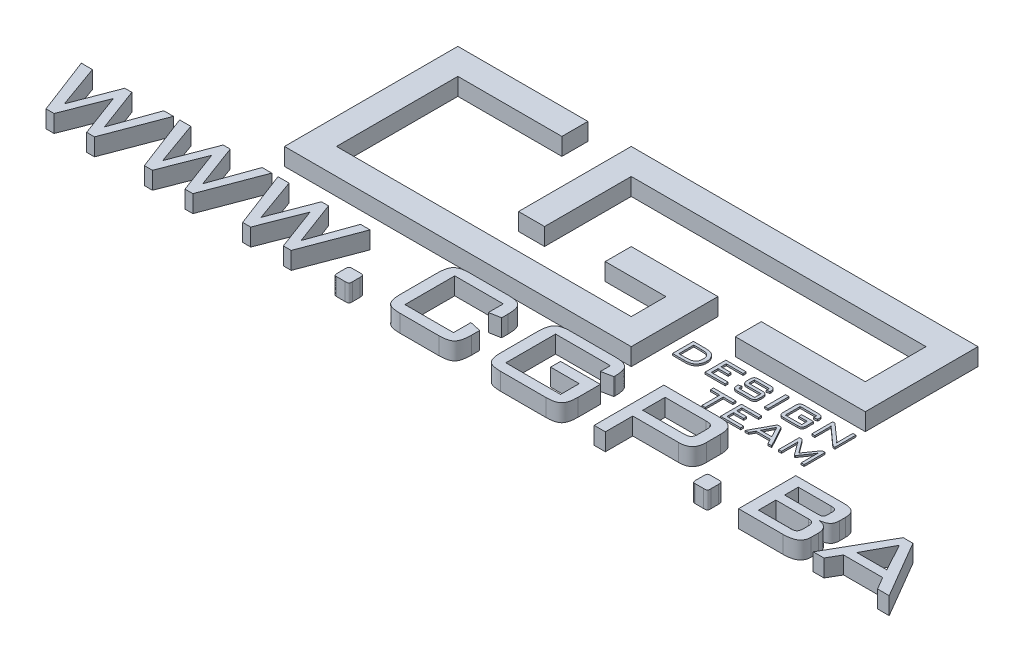
from build123d import *

# Parameters (mm, degrees)
BOSS_EXTRUDE2_DEPTH    = 10
BOSS_EXTRUDE2_2_DEPTH  = 10
BOSS_EXTRUDE4_DEPTH    = 1
BOSS_EXTRUDE4_2_DEPTH  = 1
SKETCH6_W              = 1.938419887
SKETCH6_H              = 12.061279297
BOSS_EXTRUDE4_3_DEPTH  = 1
BOSS_EXTRUDE4_4_DEPTH  = 1
BOSS_EXTRUDE4_5_DEPTH  = 1
BOSS_EXTRUDE4_6_DEPTH  = 1
BOSS_EXTRUDE4_7_DEPTH  = 1
BOSS_EXTRUDE4_8_DEPTH  = 1
BOSS_EXTRUDE4_9_DEPTH  = 1
BOSS_EXTRUDE4_10_DEPTH = 1
BOSS_EXTRUDE6_DEPTH    = 10
BOSS_EXTRUDE6_2_DEPTH  = 10
BOSS_EXTRUDE6_3_DEPTH  = 10
BOSS_EXTRUDE6_4_DEPTH  = 10
BOSS_EXTRUDE6_5_DEPTH  = 10
BOSS_EXTRUDE6_6_DEPTH  = 10
BOSS_EXTRUDE6_7_DEPTH  = 10
BOSS_EXTRUDE6_8_DEPTH  = 10
BOSS_EXTRUDE6_9_DEPTH  = 10
BOSS_EXTRUDE6_10_DEPTH = 10


with BuildPart() as part:
    # Sketch4 → Boss-Extrude2 (new body)
    with BuildSketch(Plane(origin=(0, 0, 0), x_dir=(1, 0, 0), z_dir=(0, 1, 0))):
        Polygon((-150, -35), (50, -35), (50, 15), (0, 15), (0, 0), (35, 0), (35, -20), (-135, -20), (-135, 50), (-75, 50), (-75, 65), (-150, 65), align=None)
    extrude(amount=BOSS_EXTRUDE2_DEPTH)


with BuildPart() as body_2:
    # Sketch4 → Boss-Extrude2 2 (new body)
    with BuildSketch(Plane(origin=(0, 0, 0), x_dir=(1, 0, 0), z_dir=(0, 1, 0))):
        Polygon((-50, 65), (150, 65), (150, 0), (75, 0), (75, 15), (135, 15), (135, 50), (-35, 50), (-35, 0), (-50, 0), align=None)
    extrude(amount=BOSS_EXTRUDE2_2_DEPTH)


with BuildPart() as body_3:
    # Sketch6 → Boss-Extrude4 (new body)
    with BuildSketch(Plane(origin=(0, 0, 0), x_dir=(1, 0, 0), z_dir=(0, 1, 0))):
        with BuildLine():
            Line((136.631120954, -17.5), (136.631120954, -5.438720703))
            Line((136.631120954, -5.438720703), (137.913304942, -5.438720703))
            Line((137.913304942, -5.438720703), (147.04003191, -13.505374295))
            add(Edge.make_bspline(
                [(147.04003191, -13.505374295), (147.148999707, -13.605031879), (147.380381174, -13.816644104), (147.718242534, -14.178371126), (148.07760419, -14.581428781), (148.312267847, -14.872856586), (148.433271204, -15.023130144)],
                knots=[0, 0, 0, 0, 0.858802565, 1.823575424, 2.877735548, 4, 4, 4, 4], degree=3))
            add(Edge.make_bspline(
                [(148.433271204, -15.023130144), (148.407039749, -14.824752386), (148.353645551, -14.420953902), (148.309858819, -13.899598533), (148.282449843, -13.441664675), (148.269951373, -13.034312592), (148.264239897, -12.566469802), (148.262541225, -12.234409631), (148.261640276, -12.058290005)],
                knots=[0, 0, 0, 0, 1.21154109, 2.466095284, 3.166918803, 3.989271989, 4.933540672, 6, 6, 6, 6], degree=3))
            Line((148.261640276, -12.058290005), (148.261640276, -5.438720703))
            Line((148.261640276, -5.438720703), (149.984680176, -5.438720703))
            Line((149.984680176, -5.438720703), (149.984680176, -17.5))
            Line((149.984680176, -17.5), (148.840473992, -17.5))
            Line((148.840473992, -17.5), (139.468079226, -9.113641739))
            add(Edge.make_bspline(
                [(139.468079226, -9.113641739), (139.438786765, -9.089108547), (139.368068506, -9.029880184), (139.299560768, -8.96810307), (139.259429864, -8.931914874)],
                knots=[0, 0, 0, 0, 0.828427125, 2, 2, 2, 2], degree=3))
            add(Edge.make_bspline(
                [(139.259429864, -8.931914874), (139.149023771, -8.83144387), (138.937597844, -8.639043481), (138.659300892, -8.337452934), (138.418621926, -8.049366339), (138.288478785, -7.849553071), (138.226278986, -7.754055568)],
                knots=[0, 0, 0, 0, 1.138972217, 2.181113843, 3.130692929, 4, 4, 4, 4], degree=3))
            add(Edge.make_bspline(
                [(138.226278986, -7.754055568), (138.246982097, -7.942369052), (138.289795582, -8.331796353), (138.317736577, -8.831852946), (138.333677003, -9.259468693), (138.350775735, -9.612672695), (138.350010052, -9.993129946), (138.35275005, -10.256733112), (138.354160854, -10.392460414)],
                knots=[0, 0, 0, 0, 1.290039644, 2.667767836, 3.409457589, 4.204583535, 5.075553461, 6, 6, 6, 6], degree=3))
            Line((138.354160854, -10.392460414), (138.354160854, -17.5))
            Line((138.354160854, -17.5), (136.631120954, -17.5))
        make_face()
    extrude(amount=BOSS_EXTRUDE4_DEPTH)


with BuildPart() as body_4:
    # Sketch6 → Boss-Extrude4 2 (new body)
    with BuildSketch(Plane(origin=(0, 0, 0), x_dir=(1, 0, 0), z_dir=(0, 1, 0))):
        with BuildLine():
            Line((129.092821394, -7.161760603), (119.616101946, -7.161760603))
            Line((119.616101946, -7.161760603), (119.616101946, -15.7769601))
            Line((119.616101946, -15.7769601), (129.092821394, -15.7769601))
            Line((129.092821394, -15.7769601), (129.092821394, -12.546260289))
            Line((129.092821394, -12.546260289), (124.139081682, -12.546260289))
            Line((124.139081682, -12.546260289), (124.139081682, -10.823220389))
            Line((124.139081682, -10.823220389), (131.031241281, -10.823220389))
            Line((131.031241281, -10.823220389), (131.031241281, -14.703425476))
            add(Edge.make_bspline(
                [(131.031241281, -14.703425476), (131.029240672, -14.833603851), (131.025407335, -15.083036759), (130.998323512, -15.440312892), (130.956184945, -15.765611821), (130.893247422, -16.059892827), (130.809430304, -16.320778199), (130.712512591, -16.551546602), (130.594175515, -16.749288838), (130.454020206, -16.918069161), (130.287027854, -17.060818932), (130.088541679, -17.176850849), (129.862204403, -17.278980877), (129.602409974, -17.356915005), (129.313292734, -17.426916952), (128.989348739, -17.466315152), (128.634517926, -17.494371537), (128.387296036, -17.498069389), (128.258223942, -17.5)],
                knots=[0, 0, 0, 0, 1.341190487, 2.569835741, 3.68954282, 4.718799939, 5.665508232, 6.509330321, 7.292302471, 8.030757046, 8.760384973, 9.543357123, 10.391836669, 11.31301249, 12.333536439, 13.453243518, 14.670363738, 16, 16, 16, 16], degree=3))
            Line((128.258223942, -17.5), (120.430507524, -17.5))
            add(Edge.make_bspline(
                [(120.430507524, -17.5), (120.301470114, -17.497865896), (120.054314655, -17.493778279), (119.699982113, -17.468453148), (119.378731791, -17.420439307), (119.08835604, -17.359470716), (118.830858741, -17.273990817), (118.602948759, -17.175379816), (118.409245339, -17.05347723), (118.244630104, -16.911391519), (118.1075862, -16.742432501), (117.993841919, -16.542211673), (117.891244638, -16.314640419), (117.81814287, -16.0517122), (117.751572286, -15.761459914), (117.710913381, -15.436855341), (117.683515521, -15.080816647), (117.679677056, -14.832490187), (117.677682059, -14.703425476)],
                knots=[0, 0, 0, 0, 1.33465139, 2.556362349, 3.670429294, 4.692237, 5.62044689, 6.472126735, 7.254275244, 7.977872778, 8.71172152, 9.491715939, 10.353997527, 11.286331046, 12.308138752, 13.432069147, 14.66534861, 16, 16, 16, 16], degree=3))
            Line((117.677682059, -14.703425476), (117.677682059, -8.339619909))
            add(Edge.make_bspline(
                [(117.677682059, -8.339619909), (117.679701896, -8.206072691), (117.683593145, -7.948791738), (117.710682493, -7.580393231), (117.752032423, -7.243601915), (117.817946163, -6.942068428), (117.890413252, -6.668770719), (117.995189815, -6.43338972), (118.105314759, -6.224206876), (118.245863663, -6.051358995), (118.407557151, -5.901503046), (118.603829182, -5.777920458), (118.828969184, -5.669528732), (119.089083014, -5.587328545), (119.37843619, -5.521253509), (119.699726539, -5.469402194), (120.054339542, -5.445194619), (120.30147865, -5.440941312), (120.430507524, -5.438720703)],
                knots=[0, 0, 0, 0, 1.355439748, 2.611277393, 3.748231333, 4.795615825, 5.743446092, 6.610626162, 7.405817554, 8.134917758, 8.860273934, 9.634062408, 10.479515055, 11.390516792, 12.395899027, 13.491030243, 14.690091812, 16, 16, 16, 16], degree=3))
            Line((120.430507524, -5.438720703), (128.258223942, -5.438720703))
            add(Edge.make_bspline(
                [(128.258223942, -5.438720703), (128.385008919, -5.440936176), (128.629902774, -5.445215514), (128.980989849, -5.469829301), (129.300820651, -5.519074457), (129.591130795, -5.577887869), (129.847798667, -5.669891787), (130.07856547, -5.765382602), (130.274295563, -5.890601198), (130.443170122, -6.03253598), (130.583778417, -6.203844676), (130.705921247, -6.400259016), (130.805367731, -6.628868484), (130.890162344, -6.885423152), (130.951822654, -7.173365919), (130.999454863, -7.490200289), (131.024996866, -7.83777485), (131.029104306, -8.079332442), (131.031241281, -8.205007417)],
                knots=[0, 0, 0, 0, 1.319102502, 2.547936714, 3.656955919, 4.68472133, 5.622055139, 6.489364307, 7.276073175, 8.02917657, 8.774738291, 9.571337848, 10.427983459, 11.361605328, 12.377979269, 13.486998473, 14.692562713, 16, 16, 16, 16], degree=3))
            Line((131.031241281, -8.205007417), (131.031241281, -8.494424275))
            Line((131.031241281, -8.494424275), (129.092821394, -8.884800502))
            Line((129.092821394, -8.884800502), (129.092821394, -7.161760603))
        make_face()
    extrude(amount=BOSS_EXTRUDE4_2_DEPTH)


with BuildPart() as body_5:
    # Sketch6 → Boss-Extrude4 3 (new body)
    with BuildSketch(Plane(origin=(0, 0, 0), x_dir=(1, 0, 0), z_dir=(0, 1, 0))):
        with Locations((110.46245248, -11.469360352)):
            Rectangle(SKETCH6_W, SKETCH6_H)
    extrude(amount=BOSS_EXTRUDE4_3_DEPTH)


with BuildPart() as body_6:
    # Sketch6 → Boss-Extrude4 4 (new body)
    with BuildSketch(Plane(origin=(0, 0, 0), x_dir=(1, 0, 0), z_dir=(0, 1, 0))):
        with BuildLine():
            Line((101.739562988, -7.161760603), (93.124363491, -7.161760603))
            Line((93.124363491, -7.161760603), (93.124363491, -10.392460414))
            Line((93.124363491, -10.392460414), (100.793910231, -10.392460414))
            add(Edge.make_bspline(
                [(100.793910231, -10.392460414), (100.926315037, -10.39460848), (101.181315338, -10.398745471), (101.547895567, -10.424204124), (101.881652965, -10.471501667), (102.183777389, -10.534091865), (102.453949684, -10.616840533), (102.690942474, -10.721256621), (102.895521039, -10.842067417), (103.070214619, -10.984056735), (103.218262707, -11.153331082), (103.342165339, -11.354194308), (103.446659757, -11.587592821), (103.534299058, -11.852244692), (103.594216485, -12.152174648), (103.64767452, -12.481756913), (103.671375454, -12.8465605), (103.675718094, -13.100400763), (103.677982875, -13.232783999)],
                knots=[0, 0, 0, 0, 1.328543116, 2.558660091, 3.684011556, 4.708296874, 5.651654792, 6.513321266, 7.300863837, 8.028632613, 8.762382081, 9.546216273, 10.38734976, 11.323428157, 12.336709029, 13.452564641, 14.671456884, 16, 16, 16, 16], degree=3))
            Line((103.677982875, -13.232783999), (103.677982875, -14.602466106))
            add(Edge.make_bspline(
                [(103.677982875, -14.602466106), (103.675936806, -14.738247909), (103.672026334, -14.997755709), (103.645563456, -15.370899961), (103.600469564, -15.709804605), (103.532446563, -16.014406615), (103.450495172, -16.286137409), (103.345628519, -16.522950316), (103.225127485, -16.728566587), (103.080360536, -16.902428938), (102.90704233, -17.046067187), (102.7038159, -17.168739105), (102.46826304, -17.271594145), (102.198247135, -17.355211208), (101.895534925, -17.421970707), (101.557914424, -17.467915633), (101.186941075, -17.493886541), (100.928565144, -17.497905489), (100.793910231, -17.5)],
                knots=[0, 0, 0, 0, 1.346293302, 2.57305181, 3.707213295, 4.732700712, 5.664975709, 6.516519004, 7.294809232, 8.021131687, 8.747454142, 9.516227799, 10.367771094, 11.289435408, 12.314922825, 13.438067717, 14.664826225, 16, 16, 16, 16], degree=3))
            Line((100.793910231, -17.5), (93.689735958, -17.5))
            add(Edge.make_bspline(
                [(93.689735958, -17.5), (93.562930817, -17.497924324), (93.320234952, -17.493951629), (92.971641675, -17.467836063), (92.655303637, -17.42194617), (92.369955379, -17.355413733), (92.116629655, -17.267606913), (91.891523053, -17.164385148), (91.698478005, -17.040074738), (91.534063884, -16.894347143), (91.396352542, -16.721438064), (91.282679942, -16.515785908), (91.184955561, -16.277461606), (91.10598359, -16.006641544), (91.045808256, -15.702478352), (91.00341314, -15.366248375), (90.976455197, -14.995517581), (90.97258211, -14.737128087), (90.970563616, -14.602466106)],
                knots=[0, 0, 0, 0, 1.295366464, 2.479237682, 3.568301104, 4.557797364, 5.467429819, 6.303022328, 7.081754597, 7.804059379, 8.537817863, 9.328099936, 10.196370306, 11.164467711, 12.205002338, 13.360583175, 14.624444467, 16, 16, 16, 16], degree=3))
            Line((90.970563616, -14.602466106), (90.970563616, -14.272665501))
            Line((90.970563616, -14.272665501), (92.693603516, -13.838540213))
            Line((92.693603516, -13.838540213), (92.693603516, -15.7769601))
            Line((92.693603516, -15.7769601), (101.954942976, -15.7769601))
            Line((101.954942976, -15.7769601), (101.954942976, -12.115500314))
            Line((101.954942976, -12.115500314), (94.137322494, -12.115500314))
            add(Edge.make_bspline(
                [(94.137322494, -12.115500314), (94.009382208, -12.113496013), (93.76330155, -12.109640937), (93.410579402, -12.082392396), (93.089462551, -12.041277489), (92.801782352, -11.976150814), (92.544359587, -11.89827728), (92.320153917, -11.795959462), (92.126489306, -11.679244286), (91.96145508, -11.541534651), (91.828470163, -11.373628309), (91.713814146, -11.179794851), (91.615528639, -10.953841347), (91.536666042, -10.696352797), (91.476770731, -10.406650261), (91.434252591, -10.087244513), (91.407158798, -9.735560917), (91.403325611, -9.490609559), (91.401323591, -9.362674849)],
                knots=[0, 0, 0, 0, 1.336523522, 2.570672591, 3.694432872, 4.715202753, 5.649266837, 6.498934532, 7.282850333, 8.006164405, 8.730996054, 9.508843418, 10.353728782, 11.298975283, 12.317252768, 13.441013048, 14.663476478, 16, 16, 16, 16], degree=3))
            Line((91.401323591, -9.362674849), (91.401323591, -8.356446471))
            add(Edge.make_bspline(
                [(91.401323591, -8.356446471), (91.403322171, -8.220664957), (91.40714188, -7.961157708), (91.434213009, -7.588158018), (91.477286204, -7.248780294), (91.534966817, -6.941696718), (91.617407108, -6.669759207), (91.712103342, -6.430116216), (91.828598594, -6.224832866), (91.961074595, -6.046935517), (92.124990743, -5.898660352), (92.318997501, -5.774443467), (92.544938831, -5.670675894), (92.80030823, -5.58222415), (93.090319876, -5.522441906), (93.409791586, -5.468970841), (93.763432877, -5.445400363), (94.00942713, -5.441005596), (94.137322494, -5.438720703)],
                knots=[0, 0, 0, 0, 1.376570325, 2.630917618, 3.789078705, 4.844084945, 5.793995748, 6.666248003, 7.45058105, 8.18076719, 8.905262556, 9.678132743, 10.507435141, 11.420973463, 12.411545377, 13.505376956, 14.70301555, 16, 16, 16, 16], degree=3))
            Line((94.137322494, -5.438720703), (100.622279303, -5.438720703))
            add(Edge.make_bspline(
                [(100.622279303, -5.438720703), (100.751328509, -5.440821315), (100.999625134, -5.444862988), (101.357132313, -5.470958924), (101.684715321, -5.516875462), (101.980414785, -5.584236405), (102.245723566, -5.665860726), (102.476843811, -5.772842817), (102.681403281, -5.891172316), (102.853939927, -6.037155626), (103.000958262, -6.205221662), (103.127240878, -6.399952708), (103.229131473, -6.624397964), (103.31946836, -6.874471805), (103.378133755, -7.15587553), (103.432077729, -7.461701363), (103.456008961, -7.797440087), (103.460344152, -8.029995591), (103.462602888, -8.15116242)],
                knots=[0, 0, 0, 0, 1.342795848, 2.583601166, 3.727567146, 4.780942874, 5.737020864, 6.609341233, 7.426083684, 8.188290841, 8.949245691, 9.742461551, 10.593595189, 11.509125206, 12.503004008, 13.579536429, 14.738882166, 16, 16, 16, 16], degree=3))
            Line((103.462602888, -8.15116242), (103.462602888, -8.40019553))
            Line((103.462602888, -8.40019553), (101.739562988, -8.884800502))
            Line((101.739562988, -8.884800502), (101.739562988, -7.161760603))
        make_face()
    extrude(amount=BOSS_EXTRUDE4_4_DEPTH)


with BuildPart() as body_7:
    # Sketch6 → Boss-Extrude4 5 (new body)
    with BuildSketch(Plane(origin=(0, 0, 0), x_dir=(1, 0, 0), z_dir=(0, 1, 0))):
        Polygon((75.032444545, -17.5), (75.032444545, -5.438720703), (86.662963867, -5.438720703), (86.662963867, -7.161760603), (76.970864432, -7.161760603), (76.970864432, -10.177080427), (82.786124093, -10.177080427), (82.786124093, -11.900120326), (76.970864432, -11.900120326), (76.970864432, -15.7769601), (86.662963867, -15.7769601), (86.662963867, -17.5), align=None)
    extrude(amount=BOSS_EXTRUDE4_5_DEPTH)


with BuildPart() as body_8:
    # Sketch6 → Boss-Extrude4 6 (new body)
    with BuildSketch(Plane(origin=(0, 0, 0), x_dir=(1, 0, 0), z_dir=(0, 1, 0))):
        with BuildLine():
            add(Edge.make_bspline(
                [(62.85674463, -5.438720703), (63.126014858, -5.441174335), (63.641328587, -5.445869954), (64.378178176, -5.48456848), (65.043192023, -5.554530961), (65.642604853, -5.651195381), (66.18661496, -5.778404351), (66.683104453, -5.940140629), (67.138532068, -6.13223114), (67.413828752, -6.29496964), (67.547989982, -6.374277524)],
                knots=[0, 0, 0, 0, 1.333748036, 2.552449549, 3.653284149, 4.644416963, 5.558188665, 6.417438134, 7.22876497, 8, 8, 8, 8], degree=3))
            add(Edge.make_bspline(
                [(67.547989982, -6.374277524), (67.73840575, -6.508168923), (68.118575278, -6.775486228), (68.616307733, -7.27272913), (69.049025785, -7.8401829), (69.417155164, -8.471045082), (69.712374117, -9.152222561), (69.926439963, -9.871489753), (70.052569995, -10.623593223), (70.069913383, -11.135722548), (70.078704834, -11.395323481)],
                knots=[0, 0, 0, 0, 0.952233827, 1.901157072, 2.86814827, 3.869170434, 4.885987205, 5.902388466, 6.936710154, 8, 8, 8, 8], degree=3))
            add(Edge.make_bspline(
                [(70.078704834, -11.395323481), (70.071611902, -11.670665725), (70.057725662, -12.209719093), (69.92915162, -12.996713454), (69.722334748, -13.742171859), (69.427423144, -14.437306555), (69.068384529, -15.080912849), (68.626794739, -15.648696517), (68.129650887, -16.158729557), (67.742337077, -16.428884363), (67.547989982, -16.56444318)],
                knots=[0, 0, 0, 0, 1.10009359, 2.153716578, 3.178805282, 4.185820525, 5.165972868, 6.115914832, 7.054599989, 8, 8, 8, 8], degree=3))
            add(Edge.make_bspline(
                [(67.547989982, -16.56444318), (67.417128087, -16.641395016), (67.147102205, -16.800180638), (66.698468762, -16.988693115), (66.205439866, -17.150148991), (65.661899364, -17.281169638), (65.059236199, -17.382224632), (64.389199887, -17.449196271), (63.647089465, -17.494320113), (63.128289255, -17.498048519), (62.85674463, -17.5)],
                knots=[0, 0, 0, 0, 0.751442197, 1.55055711, 2.404733238, 3.320026642, 4.317797691, 5.429952807, 6.654814532, 8, 8, 8, 8], degree=3))
            Line((62.85674463, -17.5), (56.294385638, -17.5))
            Line((56.294385638, -17.5), (56.294385638, -5.438720703))
            Line((56.294385638, -5.438720703), (62.85674463, -5.438720703))
        make_face()
        with BuildLine():
            Line((62.570693084, -7.161760603), (58.232805525, -7.161760603))
            Line((58.232805525, -7.161760603), (58.232805525, -15.7769601))
            Line((58.232805525, -15.7769601), (62.570693084, -15.7769601))
            add(Edge.make_bspline(
                [(62.570693084, -15.7769601), (62.806352345, -15.773754987), (63.260220174, -15.767582099), (63.914036804, -15.720055627), (64.514699822, -15.645173966), (65.062086668, -15.535777553), (65.553668192, -15.391221258), (65.993884149, -15.220637776), (66.380799652, -15.016163554), (66.715913772, -14.774497268), (67.004678405, -14.494830785), (67.255746661, -14.178549761), (67.46071032, -13.814401811), (67.633084825, -13.414369099), (67.762141424, -12.970764901), (67.861553384, -12.489547811), (67.912172416, -11.964010938), (67.920554824, -11.600695989), (67.92490496, -11.412150042)],
                knots=[0, 0, 0, 0, 1.409644703, 2.71490448, 3.919338159, 5.028796387, 6.050167232, 6.981044467, 7.848698272, 8.660802914, 9.443886324, 10.246705002, 11.067414674, 11.9362355, 12.847037354, 13.826200672, 14.871884975, 16, 16, 16, 16], degree=3))
            add(Edge.make_bspline(
                [(67.92490496, -11.412150042), (67.92100701, -11.230271759), (67.91347923, -10.879025693), (67.856468255, -10.370935178), (67.760345726, -9.903074336), (67.625185837, -9.474323617), (67.453608838, -9.083670448), (67.242560069, -8.730628862), (66.985503914, -8.421963999), (66.693461292, -8.147592356), (66.351544154, -7.913504316), (65.964514257, -7.706819761), (65.521430384, -7.542638104), (65.031881294, -7.3987652), (64.488122164, -7.296252196), (63.895529746, -7.212690028), (63.249900914, -7.172822109), (62.802934999, -7.16554287), (62.570693084, -7.161760603)],
                knots=[0, 0, 0, 0, 1.103072798, 2.130270712, 3.096451282, 3.99597478, 4.851981305, 5.679355857, 6.481758973, 7.280982183, 8.102093443, 8.987871863, 9.935618735, 10.962816649, 12.079758563, 13.288420765, 14.591072985, 16, 16, 16, 16], degree=3))
        make_face(mode=Mode.SUBTRACT)
    extrude(amount=BOSS_EXTRUDE4_6_DEPTH)


with BuildPart() as body_9:
    # Sketch6 → Boss-Extrude4 7 (new body)
    with BuildSketch(Plane(origin=(0, 0, 0), x_dir=(1, 0, 0), z_dir=(0, 1, 0))):
        with BuildLine():
            add(Edge.make_bspline(
                [(136.540257522, -25.09588589), (136.554849111, -25.215807424), (136.584792836, -25.461901065), (136.604856609, -25.77887657), (136.619273085, -26.056018119), (136.624073649, -26.297310241), (136.63320771, -26.569837033), (136.631840457, -26.761705842), (136.631120954, -26.862674849)],
                knots=[0, 0, 0, 0, 1.228000411, 2.52000689, 3.227952835, 4.049439613, 4.973537463, 6, 6, 6, 6], degree=3))
            Line((136.631120954, -26.862674849), (136.631120954, -35))
            Line((136.631120954, -35), (134.908081055, -35))
            Line((134.908081055, -35), (134.908081055, -22.938720703))
            Line((134.908081055, -22.938720703), (136.570545333, -22.938720703))
            Line((136.570545333, -22.938720703), (142.506956237, -30.789994308))
            Line((142.506956237, -30.789994308), (148.046260289, -22.938720703))
            Line((148.046260289, -22.938720703), (149.769300188, -22.938720703))
            Line((149.769300188, -22.938720703), (149.769300188, -35))
            Line((149.769300188, -35), (148.046260289, -35))
            Line((148.046260289, -35), (148.046260289, -26.862674849))
            add(Edge.make_bspline(
                [(148.046260289, -26.862674849), (148.047305372, -26.825653657), (148.049934452, -26.73252065), (148.057416476, -26.562037987), (148.066296236, -26.331955511), (148.084054817, -26.057285453), (148.099524423, -25.772342497), (148.112982481, -25.510968439), (148.12358164, -25.289995195), (148.128267279, -25.156466303), (148.130393096, -25.09588589)],
                knots=[0, 0, 0, 0, 0.5025012, 1.264125894, 2.315320307, 3.626478431, 4.99841976, 6.187164947, 7.177539063, 8, 8, 8, 8], degree=3))
            add(Edge.make_bspline(
                [(148.130393096, -25.09588589), (148.05966568, -25.240030076), (147.929456742, -25.505399042), (147.735884505, -25.861810452), (147.57246975, -26.154522891), (147.46054281, -26.320339209), (147.410216263, -26.394896439)],
                knots=[0, 0, 0, 0, 1.295888997, 2.385727321, 3.274162517, 4, 4, 4, 4], degree=3))
            Line((147.410216263, -26.394896439), (142.739162786, -33.105329173))
            Line((142.739162786, -33.105329173), (142.217539379, -33.105329173))
            Line((142.217539379, -33.105329173), (137.361393724, -26.579988616))
            add(Edge.make_bspline(
                [(137.361393724, -26.579988616), (137.35459928, -26.571060291), (137.334612411, -26.544796293), (137.316282293, -26.517342273), (137.304183415, -26.499221121)],
                knots=[0, 0, 0, 0, 0.679890819, 2, 2, 2, 2], degree=3))
            add(Edge.make_bspline(
                [(137.304183415, -26.499221121), (137.220749105, -26.381336371), (137.057935415, -26.1512961), (136.846341812, -25.798949802), (136.670073399, -25.449940306), (136.582957489, -25.212344), (136.540257522, -25.09588589)],
                knots=[0, 0, 0, 0, 1.080229624, 2.107959819, 3.072614268, 4, 4, 4, 4], degree=3))
        make_face()
    extrude(amount=BOSS_EXTRUDE4_7_DEPTH)


with BuildPart() as body_10:
    # Sketch6 → Boss-Extrude4 8 (new body)
    with BuildSketch(Plane(origin=(0, 0, 0), x_dir=(1, 0, 0), z_dir=(0, 1, 0))):
        Polygon((115.739262172, -35), (122.261237417, -22.938720703), (124.39821073, -22.938720703), (131.031241281, -35), (128.837057659, -35), (127.312571185, -32.200060163), (119.232456344, -32.200060163), (117.704604558, -35), align=None)
        Polygon((120.067053795, -30.477020264), (126.498165607, -30.477020264), (123.277561733, -24.315133435), align=None, mode=Mode.SUBTRACT)
    extrude(amount=BOSS_EXTRUDE4_8_DEPTH)


with BuildPart() as body_11:
    # Sketch6 → Boss-Extrude4 9 (new body)
    with BuildSketch(Plane(origin=(0, 0, 0), x_dir=(1, 0, 0), z_dir=(0, 1, 0))):
        Polygon((101.524183001, -35), (101.524183001, -22.938720703), (113.154702323, -22.938720703), (113.154702323, -24.661760603), (103.462602888, -24.661760603), (103.462602888, -27.677080427), (109.277862549, -27.677080427), (109.277862549, -29.400120326), (103.462602888, -29.400120326), (103.462602888, -33.2769601), (113.154702323, -33.2769601), (113.154702323, -35), align=None)
    extrude(amount=BOSS_EXTRUDE4_9_DEPTH)


with BuildPart() as body_12:
    # Sketch6 → Boss-Extrude4 10 (new body)
    with BuildSketch(Plane(origin=(0, 0, 0), x_dir=(1, 0, 0), z_dir=(0, 1, 0))):
        Polygon((92.693603516, -24.661760603), (92.693603516, -35), (90.755183629, -35), (90.755183629, -24.661760603), (85.370683943, -24.661760603), (85.370683943, -22.938720703), (98.293483189, -22.938720703), (98.293483189, -24.661760603), align=None)
    extrude(amount=BOSS_EXTRUDE4_10_DEPTH)


with BuildPart() as body_13:
    # Sketch9 → Boss-Extrude6 (new body)
    with BuildSketch(Plane(origin=(0, 0, 0), x_dir=(1, 0, 0), z_dir=(0, 1, 0))):
        Polygon((-237.546177819, -85), (-250.199752081, -51.975068592), (-243.794440996, -51.975068592), (-234.764186314, -77.203693163), (-225.128175418, -51.975068592), (-221.05614753, -51.975068592), (-211.644490787, -77.203693163), (-202.603018397, -51.975068592), (-197.072688511, -51.975068592), (-209.569214866, -85), (-214.089951061, -85), (-223.27725365, -60.388349351), (-232.913264547, -85), align=None)
    extrude(amount=BOSS_EXTRUDE6_DEPTH)


with BuildPart() as body_14:
    # Sketch9 → Boss-Extrude6 2 (new body)
    with BuildSketch(Plane(origin=(0, 0, 0), x_dir=(1, 0, 0), z_dir=(0, 1, 0))):
        Polygon((-180.829447792, -85), (-193.483022054, -51.975068592), (-187.077710969, -51.975068592), (-178.047456287, -77.203693163), (-168.411445391, -51.975068592), (-164.339417503, -51.975068592), (-154.92776076, -77.203693163), (-145.88628837, -51.975068592), (-140.355958484, -51.975068592), (-152.852484839, -85), (-157.373221034, -85), (-166.560523624, -60.388349351), (-176.19653452, -85), align=None)
    extrude(amount=BOSS_EXTRUDE6_2_DEPTH)


with BuildPart() as body_15:
    # Sketch9 → Boss-Extrude6 3 (new body)
    with BuildSketch(Plane(origin=(0, 0, 0), x_dir=(1, 0, 0), z_dir=(0, 1, 0))):
        Polygon((-124.112717765, -85), (-136.766292027, -51.975068592), (-130.360980942, -51.975068592), (-121.33072626, -77.203693163), (-111.694715364, -51.975068592), (-107.622687476, -51.975068592), (-98.211030733, -77.203693163), (-89.169558343, -51.975068592), (-83.639228457, -51.975068592), (-96.135754812, -85), (-100.656491007, -85), (-109.843793597, -60.388349351), (-119.479804493, -85), align=None)
    extrude(amount=BOSS_EXTRUDE6_3_DEPTH)


with BuildPart() as body_16:
    # Sketch9 → Boss-Extrude6 4 (new body)
    with BuildSketch(Plane(origin=(0, 0, 0), x_dir=(1, 0, 0), z_dir=(0, 1, 0))):
        with BuildLine():
            add(Edge.make_bspline(
                [(-65.186099325, -76.384800502), (-64.938956865, -76.38661183), (-64.495429898, -76.389862477), (-63.911946708, -76.466764326), (-63.477413994, -76.573146404), (-63.171866208, -76.767772324), (-63.010969122, -77.071233087), (-62.887223452, -77.444596399), (-62.830461955, -77.935195699), (-62.823171717, -78.295569398), (-62.819163005, -78.493729546)],
                knots=[0, 0, 0, 0, 1.538796082, 2.761555265, 3.661116975, 4.314056044, 4.941546075, 5.752190709, 6.763987982, 8, 8, 8, 8], degree=3))
            Line((-62.819163005, -78.493729546), (-62.819163005, -82.96959491))
            add(Edge.make_bspline(
                [(-62.819163005, -82.96959491), (-62.823752598, -83.167774976), (-62.832002304, -83.523999863), (-62.880893535, -84.004427296), (-62.976319052, -84.369421), (-63.124491261, -84.66260492), (-63.433469379, -84.834602252), (-63.8677956, -84.927703616), (-64.470228864, -84.992125697), (-64.927913792, -84.997160057), (-65.186099325, -85)],
                knots=[0, 0, 0, 0, 1.241128253, 2.230904361, 3.008784951, 3.606767329, 4.216987069, 5.136494925, 6.3846626, 8, 8, 8, 8], degree=3))
            Line((-65.186099325, -85), (-69.875101135, -85))
            add(Edge.make_bspline(
                [(-69.875101135, -85), (-70.013685801, -84.996266298), (-70.270364373, -84.98935095), (-70.620979391, -84.926676998), (-70.901473846, -84.814369899), (-71.131439789, -84.647010986), (-71.278440271, -84.371019291), (-71.372159207, -84.003814875), (-71.421691663, -83.524218087), (-71.429833127, -83.167852983), (-71.434362502, -82.96959491)],
                knots=[0, 0, 0, 0, 1.0915796, 2.02176115, 2.787698927, 3.459470797, 4.212265808, 5.191533172, 6.43755403, 8, 8, 8, 8], degree=3))
            Line((-71.434362502, -82.96959491), (-71.434362502, -78.493729546))
            add(Edge.make_bspline(
                [(-71.434362502, -78.493729546), (-71.430924191, -78.295404825), (-71.424671284, -77.934731835), (-71.36176639, -77.447076194), (-71.255727796, -77.069795164), (-71.09152683, -76.76381962), (-70.777391378, -76.576829273), (-70.342301449, -76.465538702), (-69.757831117, -76.39031106), (-69.314473998, -76.386772347), (-69.067426182, -76.384800502)],
                knots=[0, 0, 0, 0, 1.23413041, 2.244387401, 3.04674342, 3.67327821, 4.344456423, 5.242648711, 6.463546461, 8, 8, 8, 8], degree=3))
            Line((-69.067426182, -76.384800502), (-65.186099325, -76.384800502))
        make_face()
    extrude(amount=BOSS_EXTRUDE6_4_DEPTH)


with BuildPart() as body_17:
    # Sketch9 → Boss-Extrude6 5 (new body)
    with BuildSketch(Plane(origin=(0, 0, 0), x_dir=(1, 0, 0), z_dir=(0, 1, 0))):
        with BuildLine():
            Line((-8.256232852, -50.539202009), (-36.25563122, -50.539202009))
            Line((-36.25563122, -50.539202009), (-36.25563122, -79.256533668))
            Line((-36.25563122, -79.256533668), (-8.256232852, -79.256533668))
            Line((-8.256232852, -79.256533668), (-8.256232852, -69.205467587))
            Line((-8.256232852, -69.205467587), (-1.794833229, -70.607681047))
            Line((-1.794833229, -70.607681047), (-1.794833229, -75.352771396))
            add(Edge.make_bspline(
                [(-1.794833229, -75.352771396), (-1.803611193, -75.801464118), (-1.820522363, -76.66589219), (-1.883845093, -77.908008783), (-2.05239416, -79.032751812), (-2.239884552, -80.050133506), (-2.516895545, -80.946577413), (-2.817745696, -81.748609286), (-3.218105122, -82.419758987), (-3.660416615, -83.007304964), (-4.206272857, -83.486566394), (-4.847610208, -83.892984799), (-5.593223602, -84.241991627), (-6.451162369, -84.513706462), (-7.410256557, -84.741129452), (-8.476503508, -84.892322262), (-9.649478905, -84.979939589), (-10.465958268, -84.993117407), (-10.892394157, -85)],
                knots=[0, 0, 0, 0, 1.371830684, 2.64289768, 3.796878273, 4.845799251, 5.800323197, 6.661932991, 7.455771661, 8.180458924, 8.900807787, 9.661630497, 10.494960316, 11.409299866, 12.407237764, 13.504657088, 14.69671688, 16, 16, 16, 16], degree=3))
            Line((-10.892394157, -85), (-33.507292838, -85))
            add(Edge.make_bspline(
                [(-33.507292838, -85), (-33.933718427, -84.993015139), (-34.753906441, -84.979580441), (-35.934418255, -84.892447347), (-37.011557744, -84.740510212), (-37.979214769, -84.51616256), (-38.842156635, -84.238504836), (-39.600359849, -83.895399538), (-40.245900201, -83.474134067), (-40.80553256, -82.996865285), (-41.262666339, -82.412644159), (-41.654362055, -81.731695664), (-41.994405622, -80.938646298), (-42.250162627, -80.031574133), (-42.470795795, -79.021244468), (-42.60609965, -77.898402744), (-42.697802098, -76.663031527), (-42.710442951, -75.801675003), (-42.717030843, -75.352771396)],
                knots=[0, 0, 0, 0, 1.297259025, 2.495151162, 3.598753169, 4.603154866, 5.513268114, 6.353056325, 7.126090131, 7.85163119, 8.580020311, 9.370189664, 10.236523983, 11.197537223, 12.232772674, 13.379897413, 14.634510254, 16, 16, 16, 16], degree=3))
            Line((-42.717030843, -75.352771396), (-42.717030843, -54.364440328))
            add(Edge.make_bspline(
                [(-42.717030843, -54.364440328), (-42.71039871, -53.919286785), (-42.697677362, -53.065420681), (-42.606644544, -51.841082711), (-42.468790437, -50.726317816), (-42.254638599, -49.725375785), (-41.98912929, -48.828944095), (-41.658137003, -48.043272548), (-41.259186842, -47.370030832), (-40.805485752, -46.788139553), (-40.249095403, -46.309002694), (-39.596545793, -45.902607474), (-38.842753882, -45.556289588), (-37.979030795, -45.279863057), (-37.011614552, -45.055135936), (-35.934401048, -44.903315448), (-34.75391132, -44.816147546), (-33.933720096, -44.802717907), (-33.507292838, -44.795735677)],
                knots=[0, 0, 0, 0, 1.360215605, 2.609081786, 3.750041755, 4.789939032, 5.733390305, 6.603625863, 7.387504429, 8.1191736, 8.847981884, 9.618334873, 10.461904781, 11.37611641, 12.385041084, 13.493612783, 14.696899215, 16, 16, 16, 16], degree=3))
            Line((-33.507292838, -44.795735677), (-10.892394157, -44.795735677))
            add(Edge.make_bspline(
                [(-10.892394157, -44.795735677), (-10.466005197, -44.802795371), (-9.649615685, -44.816312279), (-8.47602657, -44.90161352), (-7.412657047, -45.060419981), (-6.446519755, -45.26261362), (-5.598786619, -45.560607191), (-4.844707278, -45.888440233), (-4.20615667, -46.298522783), (-3.664418379, -46.776464852), (-3.214102271, -47.354242636), (-2.821139376, -48.022612584), (-2.516184399, -48.814906216), (-2.238328301, -49.704086748), (-2.053741964, -50.714577993), (-1.883524051, -51.831538215), (-1.820591313, -53.06254547), (-1.803636566, -53.91949187), (-1.794833229, -54.364440328)],
                knots=[0, 0, 0, 0, 1.308876855, 2.506053008, 3.608182492, 4.60783723, 5.529752035, 6.361843922, 7.12593211, 7.849372733, 8.568155083, 9.365400936, 10.220062916, 11.167696093, 12.221119074, 13.368687144, 14.63375516, 16, 16, 16, 16], degree=3))
            Line((-1.794833229, -54.364440328), (-1.794833229, -57.965324493))
            Line((-1.794833229, -57.965324493), (-8.256232852, -59.154401507))
            Line((-8.256232852, -59.154401507), (-8.256232852, -50.539202009))
        make_face()
    extrude(amount=BOSS_EXTRUDE6_5_DEPTH)


with BuildPart() as body_18:
    # Sketch9 → Boss-Extrude6 6 (new body)
    with BuildSketch(Plane(origin=(0, 0, 0), x_dir=(1, 0, 0), z_dir=(0, 1, 0))):
        with BuildLine():
            Line((53.486030215, -50.539202009), (21.89696539, -50.539202009))
            Line((21.89696539, -50.539202009), (21.89696539, -79.256533668))
            Line((21.89696539, -79.256533668), (53.486030215, -79.256533668))
            Line((53.486030215, -79.256533668), (53.486030215, -68.487534296))
            Line((53.486030215, -68.487534296), (36.973564511, -68.487534296))
            Line((36.973564511, -68.487534296), (36.973564511, -62.744067964))
            Line((36.973564511, -62.744067964), (59.947429839, -62.744067964))
            Line((59.947429839, -62.744067964), (59.947429839, -75.678084918))
            add(Edge.make_bspline(
                [(59.947429839, -75.678084918), (59.940761143, -76.112012837), (59.927983352, -76.943455862), (59.837703942, -78.134376308), (59.697242054, -79.218706072), (59.487450309, -80.199642755), (59.208059916, -81.069260663), (58.885000872, -81.838488675), (58.490543954, -82.497629461), (58.02335959, -83.060230537), (57.466718418, -83.536063106), (56.805097831, -83.922836162), (56.050640246, -84.263269589), (55.184658818, -84.523050018), (54.220934685, -84.75638984), (53.141121367, -84.887717173), (51.958351991, -84.981238458), (51.134279022, -84.993564629), (50.704038711, -85)],
                knots=[0, 0, 0, 0, 1.341190487, 2.569835741, 3.68954282, 4.718799939, 5.665508232, 6.509330321, 7.292302471, 8.030757046, 8.760384973, 9.543357123, 10.391836669, 11.31301249, 12.333536439, 13.453243518, 14.670363738, 16, 16, 16, 16], degree=3))
            Line((50.704038711, -85), (24.611650649, -85))
            add(Edge.make_bspline(
                [(24.611650649, -85), (24.181525949, -84.99288632), (23.35767442, -84.97926093), (22.176565947, -84.894843826), (21.105731539, -84.734797689), (20.137812368, -84.531569052), (19.279488041, -84.246636055), (18.5197881, -83.917932719), (17.874110034, -83.511590766), (17.325392583, -83.037971729), (16.868579569, -82.474775004), (16.489431965, -81.807372245), (16.147441031, -81.048801395), (15.903768471, -80.172374), (15.681866524, -79.204866379), (15.546336838, -78.122851138), (15.455010638, -76.936055492), (15.442215755, -76.108300624), (15.435565767, -75.678084918)],
                knots=[0, 0, 0, 0, 1.33465139, 2.556362349, 3.670429294, 4.692237, 5.62044689, 6.472126735, 7.254275244, 7.977872778, 8.71172152, 9.491715939, 10.353997527, 11.286331046, 12.308138752, 13.432069147, 14.66534861, 16, 16, 16, 16], degree=3))
            Line((15.435565767, -75.678084918), (15.435565767, -54.465399697))
            add(Edge.make_bspline(
                [(15.435565767, -54.465399697), (15.442298555, -54.020242304), (15.455269385, -53.162639125), (15.545567213, -51.934644103), (15.683400312, -50.812006383), (15.903112779, -49.80689476), (16.144669742, -48.895902396), (16.493924954, -48.111299066), (16.861008099, -47.41402292), (17.329504447, -46.837863316), (17.868482738, -46.338343488), (18.522722845, -45.926401526), (19.273189515, -45.565095775), (20.140235616, -45.291095151), (21.104746201, -45.070845029), (22.175714033, -44.898007314), (23.357757376, -44.817315397), (24.181554404, -44.803137708), (24.611650649, -44.795735677)],
                knots=[0, 0, 0, 0, 1.355439748, 2.611277393, 3.748231333, 4.795615825, 5.743446092, 6.610626162, 7.405817554, 8.134917758, 8.860273934, 9.634062408, 10.479515055, 11.390516792, 12.395899027, 13.491030243, 14.690091812, 16, 16, 16, 16], degree=3))
            Line((24.611650649, -44.795735677), (50.704038711, -44.795735677))
            add(Edge.make_bspline(
                [(50.704038711, -44.795735677), (51.1266553, -44.803120587), (51.942968151, -44.817385047), (53.1132584, -44.899431005), (54.179361073, -45.063581523), (55.147061554, -45.259626229), (56.002621126, -45.566305956), (56.771843803, -45.884608672), (57.424277447, -46.302003993), (57.987192642, -46.775119932), (58.455886961, -47.346148918), (58.863029725, -48.000863387), (59.194518006, -48.762894947), (59.477166718, -49.618077174), (59.682701083, -50.577886398), (59.841475113, -51.634000964), (59.926615124, -52.792582834), (59.94030659, -53.597774808), (59.947429839, -54.01669139)],
                knots=[0, 0, 0, 0, 1.319102502, 2.547936714, 3.656955919, 4.68472133, 5.622055139, 6.489364307, 7.276073175, 8.02917657, 8.774738291, 9.571337848, 10.427983459, 11.361605328, 12.377979269, 13.486998473, 14.692562713, 16, 16, 16, 16], degree=3))
            Line((59.947429839, -54.01669139), (59.947429839, -54.98141425))
            Line((59.947429839, -54.98141425), (53.486030215, -56.282668341))
            Line((53.486030215, -56.282668341), (53.486030215, -50.539202009))
        make_face()
    extrude(amount=BOSS_EXTRUDE6_6_DEPTH)


with BuildPart() as body_19:
    # Sketch9 → Boss-Extrude6 7 (new body)
    with BuildSketch(Plane(origin=(0, 0, 0), x_dir=(1, 0, 0), z_dir=(0, 1, 0))):
        with BuildLine():
            Line((78.613695417, -85), (78.613695417, -44.795735677))
            Line((78.613695417, -44.795735677), (111.32453101, -44.795735677))
            add(Edge.make_bspline(
                [(111.32453101, -44.795735677), (111.676239834, -44.802477635), (112.354673363, -44.815482626), (113.332642086, -44.906580131), (114.238121991, -45.047500796), (115.064034607, -45.259232736), (115.818015418, -45.528435138), (116.491400953, -45.86484544), (117.092170588, -46.258167249), (117.617948552, -46.713642059), (118.073755039, -47.239320124), (118.463738684, -47.838059133), (118.803638313, -48.501837363), (119.072347619, -49.245045725), (119.284266819, -50.059709475), (119.424243971, -50.950412606), (119.516339711, -51.909583259), (119.529213851, -52.573112925), (119.535893032, -52.917356037)],
                knots=[0, 0, 0, 0, 1.260781994, 2.432002616, 3.518530085, 4.542732807, 5.484194412, 6.383479385, 7.234929142, 8.052130222, 8.869331302, 9.72078106, 10.60809582, 11.536970088, 12.548193725, 13.621491167, 14.766015563, 16, 16, 16, 16], degree=3))
            Line((119.535893032, -52.917356037), (119.535893032, -61.184806597))
            add(Edge.make_bspline(
                [(119.535893032, -61.184806597), (119.5291544, -61.525304993), (119.516170739, -62.181360377), (119.42531865, -63.125780043), (119.283283379, -64.001346863), (119.07014147, -64.804089454), (118.80621716, -65.541726422), (118.463856176, -66.197362542), (118.070521294, -66.785955323), (117.617794668, -67.309445986), (117.095533208, -67.767092529), (116.487330809, -68.144640292), (115.82093793, -68.487766799), (115.061233979, -68.73804712), (114.238590681, -68.954955774), (113.332503155, -69.094251623), (112.354712378, -69.185824966), (111.676253154, -69.198761249), (111.32453101, -69.205467587)],
                knots=[0, 0, 0, 0, 1.228343777, 2.366711731, 3.420216182, 4.424816797, 5.359594873, 6.240544878, 7.086181298, 7.908576405, 8.730971511, 9.580473227, 10.485473941, 11.42839416, 12.459106585, 13.552539884, 14.731204635, 16, 16, 16, 16], degree=3))
            Line((111.32453101, -69.205467587), (85.07509504, -69.205467587))
            Line((85.07509504, -69.205467587), (85.07509504, -85))
            Line((85.07509504, -85), (78.613695417, -85))
        make_face()
        with BuildLine():
            Line((108.643498875, -50.539202009), (85.07509504, -50.539202009))
            Line((85.07509504, -50.539202009), (85.07509504, -63.462001256))
            Line((85.07509504, -63.462001256), (108.643498875, -63.462001256))
            add(Edge.make_bspline(
                [(108.643498875, -63.462001256), (109.033250973, -63.453827712), (109.749786308, -63.438801153), (110.727576998, -63.270624606), (111.521973359, -63.018124941), (112.140888409, -62.621086898), (112.574815969, -62.06354317), (112.878547106, -61.367558151), (113.049985768, -60.516122771), (113.065954302, -59.899300025), (113.074493408, -59.569456691)],
                knots=[0, 0, 0, 0, 1.353470045, 2.488271691, 3.437919515, 4.23469245, 5.002081093, 5.857360015, 6.854232401, 8, 8, 8, 8], degree=3))
            Line((113.074493408, -59.569456691), (113.074493408, -54.431746574))
            add(Edge.make_bspline(
                [(113.074493408, -54.431746574), (113.065951342, -54.101912413), (113.049977271, -53.485106822), (112.87857432, -52.633560787), (112.574733283, -51.937916302), (112.141167781, -51.379250717), (111.519719503, -50.986056906), (110.731514268, -50.712160636), (109.747872846, -50.568433916), (109.032795847, -50.549506393), (108.643498875, -50.539202009)],
                knots=[0, 0, 0, 0, 1.145454273, 2.14205405, 2.997099083, 3.764277872, 4.560832919, 5.514569346, 6.646900081, 8, 8, 8, 8], degree=3))
        make_face(mode=Mode.SUBTRACT)
    extrude(amount=BOSS_EXTRUDE6_7_DEPTH)


with BuildPart() as body_20:
    # Sketch9 → Boss-Extrude6 8 (new body)
    with BuildSketch(Plane(origin=(0, 0, 0), x_dir=(1, 0, 0), z_dir=(0, 1, 0))):
        with BuildLine():
            add(Edge.make_bspline(
                [(141.578688622, -76.384800502), (141.825831081, -76.38661183), (142.269358049, -76.389862477), (142.852841239, -76.466764326), (143.287373953, -76.573146404), (143.592921738, -76.767772324), (143.753818824, -77.071233087), (143.877564494, -77.444596399), (143.934325991, -77.935195699), (143.941616229, -78.295569398), (143.945624942, -78.493729546)],
                knots=[0, 0, 0, 0, 1.538796082, 2.761555265, 3.661116975, 4.314056044, 4.941546075, 5.752190709, 6.763987982, 8, 8, 8, 8], degree=3))
            Line((143.945624942, -78.493729546), (143.945624942, -82.96959491))
            add(Edge.make_bspline(
                [(143.945624942, -82.96959491), (143.941035349, -83.167774976), (143.932785642, -83.523999863), (143.883894411, -84.004427296), (143.788468895, -84.369421), (143.640296685, -84.66260492), (143.331318568, -84.834602252), (142.896992347, -84.927703616), (142.294559083, -84.992125697), (141.836874154, -84.997160057), (141.578688622, -85)],
                knots=[0, 0, 0, 0, 1.241128253, 2.230904361, 3.008784951, 3.606767329, 4.216987069, 5.136494925, 6.3846626, 8, 8, 8, 8], degree=3))
            Line((141.578688622, -85), (136.889686812, -85))
            add(Edge.make_bspline(
                [(136.889686812, -85), (136.751102146, -84.996266298), (136.494423574, -84.98935095), (136.143808555, -84.926676998), (135.863314101, -84.814369899), (135.633348158, -84.647010986), (135.486347675, -84.371019291), (135.392628739, -84.003814875), (135.343096284, -83.524218087), (135.334954819, -83.167852983), (135.330425444, -82.96959491)],
                knots=[0, 0, 0, 0, 1.0915796, 2.02176115, 2.787698927, 3.459470797, 4.212265808, 5.191533172, 6.43755403, 8, 8, 8, 8], degree=3))
            Line((135.330425444, -82.96959491), (135.330425444, -78.493729546))
            add(Edge.make_bspline(
                [(135.330425444, -78.493729546), (135.333863756, -78.295404825), (135.340116663, -77.934731835), (135.403021556, -77.447076194), (135.50906015, -77.069795164), (135.673261116, -76.76381962), (135.987396568, -76.576829273), (136.422486498, -76.465538702), (137.00695683, -76.39031106), (137.450313948, -76.386772347), (137.697361764, -76.384800502)],
                knots=[0, 0, 0, 0, 1.23413041, 2.244387401, 3.04674342, 3.67327821, 4.344456423, 5.242648711, 6.463546461, 8, 8, 8, 8], degree=3))
            Line((137.697361764, -76.384800502), (141.578688622, -76.384800502))
        make_face()
    extrude(amount=BOSS_EXTRUDE6_8_DEPTH)


with BuildPart() as body_21:
    # Sketch9 → Boss-Extrude6 9 (new body)
    with BuildSketch(Plane(origin=(0, 0, 0), x_dir=(1, 0, 0), z_dir=(0, 1, 0))):
        with BuildLine():
            Line((161.893957229, -85), (161.893957229, -51.975068592))
            Line((161.893957229, -51.975068592), (189.601695197, -51.975068592))
            add(Edge.make_bspline(
                [(189.601695197, -51.975068592), (189.919747575, -51.977809861), (190.530751648, -51.98307606), (191.414420132, -52.066876494), (192.231821202, -52.186329967), (192.982252276, -52.352769509), (193.665584794, -52.56200962), (194.274138809, -52.838099115), (194.829423248, -53.143274663), (195.461832655, -53.647085042), (196.134253055, -54.424240718), (196.697467435, -55.59006054), (197.01719428, -56.987564813), (197.053339038, -57.98972218), (197.072688511, -58.526209877)],
                knots=[0, 0, 0, 0, 0.996545736, 1.914444119, 2.779723538, 3.584458578, 4.322125898, 5.014746237, 5.676220332, 6.302270316, 7.540524137, 8.861445855, 10.31982906, 12, 12, 12, 12], degree=3))
            Line((197.072688511, -58.526209877), (197.072688511, -62.059787796))
            add(Edge.make_bspline(
                [(197.072688511, -62.059787796), (197.058805854, -62.465584441), (197.032454268, -63.23585378), (196.745517822, -64.312529636), (196.283359252, -65.240570663), (195.606673443, -66.008848398), (194.716095887, -66.606991295), (193.630001195, -67.094680704), (192.315927447, -67.427069534), (191.364479277, -67.555444328), (190.858078457, -67.623770805)],
                knots=[0, 0, 0, 0, 1.035148497, 1.964883535, 2.824140835, 3.663986196, 4.549633544, 5.546381472, 6.694080798, 8, 8, 8, 8], degree=3))
            add(Edge.make_bspline(
                [(190.858078457, -67.623770805), (191.339264418, -67.692453495), (192.252786847, -67.822846281), (193.529396551, -68.222394491), (194.609693364, -68.827288939), (195.51784273, -69.5862347), (196.223253632, -70.511037716), (196.728013508, -71.584139315), (197.017400572, -72.802531072), (197.053771707, -73.661073649), (197.072688511, -74.107605843)],
                knots=[0, 0, 0, 0, 1.163145283, 2.20820928, 3.182453751, 4.110141943, 5.023672776, 5.945071483, 6.931221624, 8, 8, 8, 8], degree=3))
            Line((197.072688511, -74.107605843), (197.072688511, -78.336681638))
            add(Edge.make_bspline(
                [(197.072688511, -78.336681638), (197.067529394, -78.610001743), (197.057586782, -79.136742101), (196.944245693, -79.9017892), (196.745483037, -80.607389065), (196.513747453, -81.27844496), (196.16142023, -81.875687503), (195.761374652, -82.433702454), (195.272218211, -82.926077226), (194.717730944, -83.371065435), (194.082505523, -83.747737993), (193.378513242, -84.08912569), (192.598568261, -84.379732444), (191.732178183, -84.600088671), (190.795074434, -84.776030913), (189.780767054, -84.912392208), (188.690570104, -84.990468116), (187.937862133, -84.996752279), (187.548854692, -85)],
                knots=[0, 0, 0, 0, 0.990576586, 1.909031417, 2.793742774, 3.647472433, 4.47318176, 5.297554266, 6.131680376, 6.980768113, 7.869004643, 8.802841722, 9.815260417, 10.880757874, 12.040114011, 13.271141541, 14.589697083, 16, 16, 16, 16], degree=3))
            Line((187.548854692, -85), (161.893957229, -85))
        make_face()
        with BuildLine():
            Line((168.355356852, -69.923400879), (168.355356852, -79.97446696))
            Line((168.355356852, -79.97446696), (187.133799508, -79.97446696))
            add(Edge.make_bspline(
                [(187.133799508, -79.97446696), (187.43724249, -79.963375516), (187.995876838, -79.942956321), (188.765974123, -79.806816089), (189.389794575, -79.554218559), (189.876926536, -79.171436991), (190.224890866, -78.645198109), (190.449400567, -77.973986125), (190.594780533, -77.157557686), (190.605496133, -76.561301144), (190.611288888, -76.238970302)],
                knots=[0, 0, 0, 0, 1.216889453, 2.240276713, 3.120382501, 3.888490308, 4.687024243, 5.611972833, 6.709054318, 8, 8, 8, 8], degree=3))
            Line((190.611288888, -76.238970302), (190.611288888, -73.658897536))
            add(Edge.make_bspline(
                [(190.611288888, -73.658897536), (190.605180332, -73.3404253), (190.593890245, -72.751811651), (190.45170357, -71.940142086), (190.211668596, -71.27698901), (189.862691384, -70.745228892), (189.3723863, -70.355991649), (188.745539471, -70.107121174), (187.986544847, -69.949917015), (187.433880843, -69.932731915), (187.133799508, -69.923400879)],
                knots=[0, 0, 0, 0, 1.280789025, 2.367207607, 3.300882875, 4.102434386, 4.894604052, 5.778035666, 6.793534549, 8, 8, 8, 8], degree=3))
            Line((187.133799508, -69.923400879), (168.355356852, -69.923400879))
        make_face(mode=Mode.SUBTRACT)
        with BuildLine():
            Line((190.611288888, -62.418754441), (190.611288888, -59.513368152))
            add(Edge.make_bspline(
                [(190.611288888, -59.513368152), (190.605081061, -59.295494239), (190.593460113, -58.887637891), (190.447695265, -58.328551556), (190.212597983, -57.871661798), (189.862745773, -57.518112099), (189.376872396, -57.28439213), (188.767805835, -57.108231212), (188.000155292, -57.016213704), (187.440597849, -57.006130259), (187.133799508, -57.000601632)],
                knots=[0, 0, 0, 0, 1.044482881, 1.955254603, 2.75103361, 3.487844391, 4.299486329, 5.311321021, 6.525830968, 8, 8, 8, 8], degree=3))
            Line((187.133799508, -57.000601632), (168.355356852, -57.000601632))
            Line((168.355356852, -57.000601632), (168.355356852, -64.897867839))
            Line((168.355356852, -64.897867839), (187.133799508, -64.897867839))
            add(Edge.make_bspline(
                [(187.133799508, -64.897867839), (187.459534689, -64.893251275), (188.053067763, -64.884839278), (188.849664525, -64.78459405), (189.475196009, -64.645478332), (189.943593056, -64.404365676), (190.257216652, -64.042414135), (190.469173953, -63.593329187), (190.588074844, -63.037889926), (190.603135105, -62.636221775), (190.611288888, -62.418754441)],
                knots=[0, 0, 0, 0, 1.556111655, 2.835443593, 3.832645842, 4.608748431, 5.304984062, 6.080468817, 6.96074576, 8, 8, 8, 8], degree=3))
        make_face(mode=Mode.SUBTRACT)
    extrude(amount=BOSS_EXTRUDE6_9_DEPTH)


with BuildPart() as body_22:
    # Sketch9 → Boss-Extrude6 10 (new body)
    with BuildSketch(Plane(origin=(0, 0, 0), x_dir=(1, 0, 0), z_dir=(0, 1, 0))):
        Polygon((204.969954718, -85), (223.826921327, -51.975068592), (229.458210582, -51.975068592), (248.763885498, -85), (242.078131721, -85), (237.837838218, -77.820667085), (215.30146349, -77.820667085), (211.128476234, -85), align=None)
        Polygon((217.892753964, -72.795134045), (235.201676914, -72.795134045), (226.530388878, -56.877206848), align=None, mode=Mode.SUBTRACT)
    extrude(amount=BOSS_EXTRUDE6_10_DEPTH)


solid = Compound([part.part, body_2.part, body_3.part, body_4.part, body_5.part, body_6.part, body_7.part, body_8.part, body_9.part, body_10.part, body_11.part, body_12.part, body_13.part, body_14.part, body_15.part, body_16.part, body_17.part, body_18.part, body_19.part, body_20.part, body_21.part, body_22.part])
